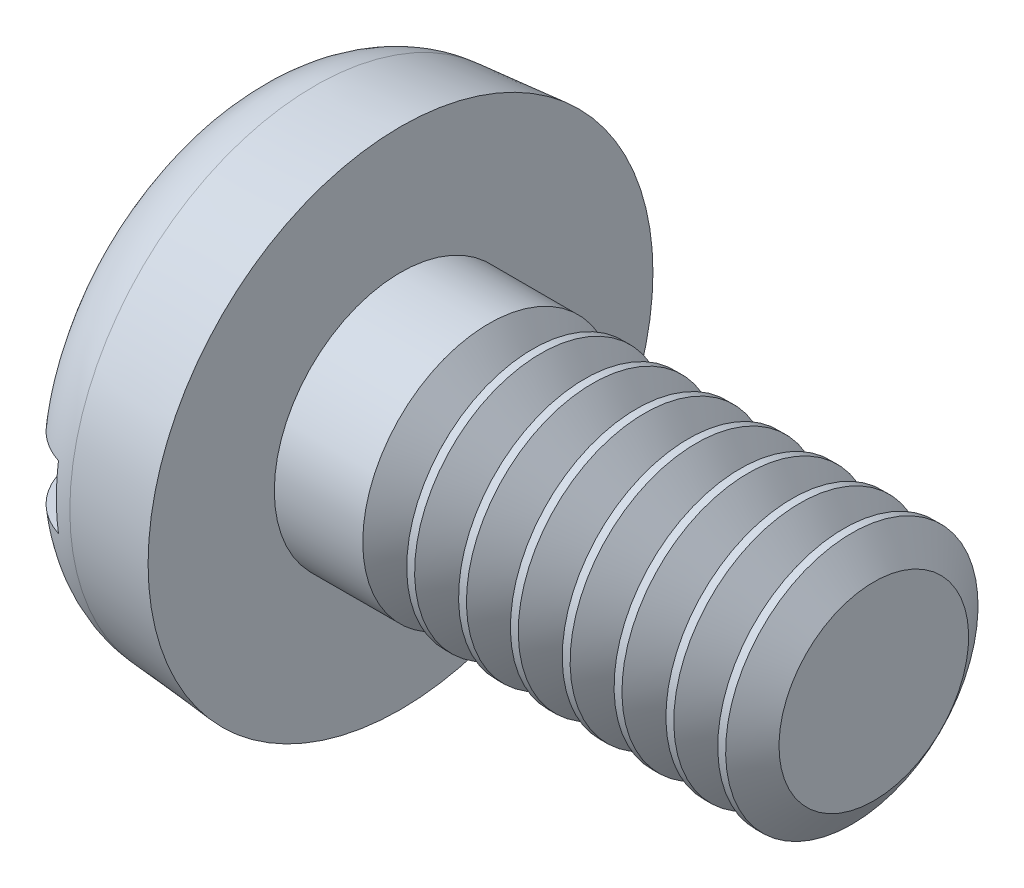
from build123d import *

# Parameters (mm, degrees)
FILLET2_R       = 0.5
SKETCH2_W       = 3.2
SKETCH2_H       = 0.4
SLOT_DEPTH      = 0.35
THDSCHPAT_COUNT = 8
THDSCHPAT_PITCH = 0.328571429


with BuildPart() as part:
    # BodySke → Base-Revolve (revolve)
    with BuildSketch(Plane.XY, mode=Mode.PRIVATE) as base_revolve_sk:
        Polygon((1, 0.8), (1, 1.6), (0, 1.512511336), (0, 0), (4, 0), (4, 0.8), align=None)
    revolve(base_revolve_sk.sketch.rotate(Axis((-25.4, 0, 0), (1, 0, 0)), 90), axis=Axis((-25.4, 0, 0), (1, 0, 0)))

    # Fillet2
    fillet2_edges = [part.edges().sort_by_distance(p)[0] for p in [
        (0, 0, -1.512511336),
    ]]
    fillet(fillet2_edges, radius=FILLET2_R)

    # Sketch2 → Slot (cut)
    with BuildSketch(Plane(origin=(0, 0, 0), x_dir=(0, 0, -1), z_dir=(1, 0, 0))):
        Rectangle(SKETCH2_W, SKETCH2_H)
    extrude(amount=SLOT_DEPTH, mode=Mode.SUBTRACT)

    # ThdSchSke → ThreadSchematic (revolve, cut)
    with BuildSketch(Plane.XY, mode=Mode.PRIVATE) as threadschematic_sk:
        Polygon((1.7, -0.601), (1.5606587, -0.8), (1.5606587, -1), (1.8393413, -1), (1.8393413, -0.8), align=None)
    threadschematic = revolve(threadschematic_sk.sketch.rotate(Axis((-3.175, 0, 0), (1, 0, 0)), 270), axis=Axis((-3.175, 0, 0), (1, 0, 0)), mode=Mode.SUBTRACT)

    # ThdSchPat: ThreadSchematic ×8
    with Locations(*[(i * THDSCHPAT_PITCH, 0, 0) for i in range(1, THDSCHPAT_COUNT)]):
        add(threadschematic, mode=Mode.SUBTRACT)


solid = part.part
